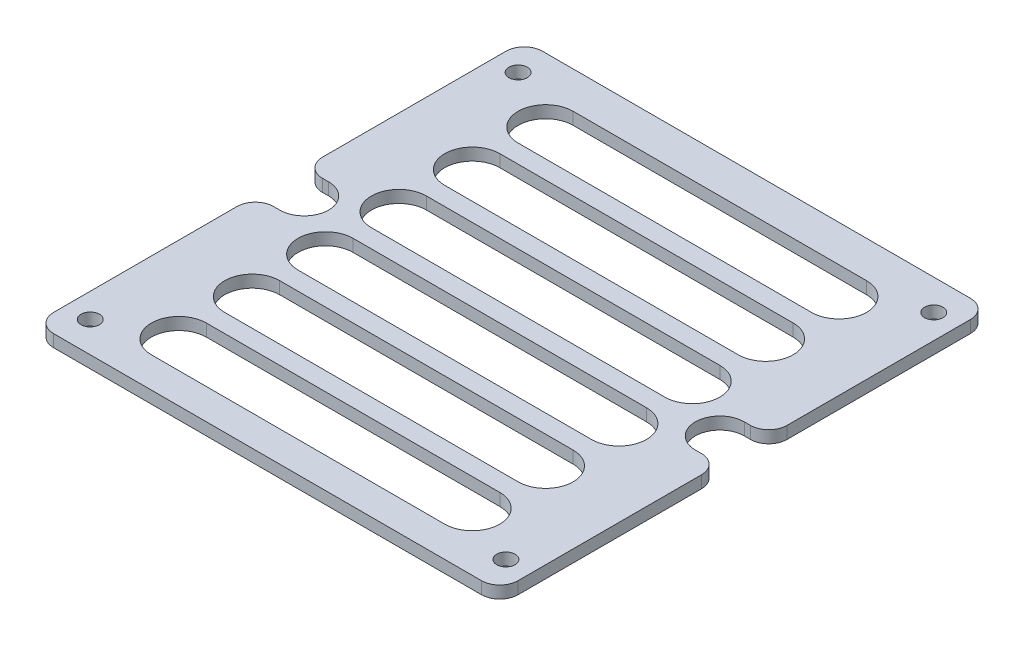
from build123d import *

# Parameters (mm, degrees)
EXTRUDE_1_DEPTH          = 2
SKETCH_2_R               = 1.5
CUT_EXTRUDE_1_DEPTH      = 56.208694967
MIRROR_2_COPY_1_SKETCH_R = 1.5
MIRROR_2_COPY_1_DEPTH    = 56.208694967
CUT_EXTRUDE_2_DEPTH      = 56.208694967
PATTERN_LINEAR_1_COUNT   = 6
PATTERN_LINEAR_1_PITCH   = 12
SKETCH_4_W               = 60
SKETCH_4_H               = 2
EXTRUDE_2_DEPTH          = 8
CUT_EXTRUDE_3_DEPTH      = 56.208694967
FILLET_1_R               = 3


with BuildPart() as part:
    # 草图1 → 凸台-拉伸1 (new body)
    with BuildSketch(Plane(origin=(0, 0, 0), x_dir=(1, 0, 0), z_dir=(0, 1, 0))):
        Polygon((-38, -30), (-38, -40), (38, -40), (38, -30), (30, -30), (30, 30), (38, 30), (38, 40), (-38, 40), (-38, 30), (-30, 30), (-30, -30), align=None)
    extrude(amount=EXTRUDE_1_DEPTH)

    # 草图2 → 切除-拉伸1 (cut, through all)
    with BuildSketch(Plane(origin=(0, 2, 0), x_dir=(1, 0, 0), z_dir=(0, 1, 0))):
        with Locations(Location((-34, 35, 0), (0, 0, 270))):
            Circle(SKETCH_2_R)
    cut_extrude_1 = extrude(amount=-CUT_EXTRUDE_1_DEPTH, mode=Mode.SUBTRACT)

    # 镜向1: 切除-拉伸1 across plane
    add(cut_extrude_1.mirror(Plane(origin=(0, 0, 0), x_dir=(0, 0, 1), z_dir=(1, 0, 0))), mode=Mode.SUBTRACT)

    # 镜向2: 切除-拉伸1 across plane
    add(cut_extrude_1.mirror(Plane.XY), mode=Mode.SUBTRACT)

    # 镜向2 copy 1 sketch → 镜向2 copy 1 (cut, through all)
    with BuildSketch(Plane(origin=(0, 2, 0), x_dir=(-1, 0, 0), z_dir=(0, 1, 0))):
        with Locations(Location((-34, 35, 0), (0, 0, 270))):
            Circle(MIRROR_2_COPY_1_SKETCH_R)
    extrude(amount=-MIRROR_2_COPY_1_DEPTH, mode=Mode.SUBTRACT)

    # 草图3 → 切除-拉伸2 (cut, through all)
    with BuildSketch(Plane(origin=(0, 2, 0), x_dir=(1, 0, 0), z_dir=(0, 1, 0))):
        with BuildLine():
            Line((-24, 34), (24, 34))
            ThreePointArc((24, 34), (28.5, 29.5), (24, 25))
            Line((24, 25), (-24, 25))
            ThreePointArc((-24, 25), (-28.5, 29.5), (-24, 34))
        make_face()
    cut_extrude_2 = extrude(amount=-CUT_EXTRUDE_2_DEPTH, mode=Mode.SUBTRACT)

    # 阵列(线性)1: 切除-拉伸2 ×6
    with Locations(*[(0, 0, i * PATTERN_LINEAR_1_PITCH) for i in range(1, PATTERN_LINEAR_1_COUNT)]):
        add(cut_extrude_2, mode=Mode.SUBTRACT)

    # 草图4 → 凸台-拉伸2 (add)
    with BuildSketch(Plane(origin=(30, 0, 0), x_dir=(0, 0, -1), z_dir=(1, 0, 0))):
        with Locations((0, 1)):
            Rectangle(SKETCH_4_W, SKETCH_4_H)
    extrude_2 = extrude(amount=EXTRUDE_2_DEPTH)

    # 镜向3: 凸台-拉伸2 across plane
    add(extrude_2.mirror(Plane(origin=(0, 0, 0), x_dir=(0, 0, 1), z_dir=(1, 0, 0))))

    # 草图6 → 切除-拉伸3 (cut, through all)
    with BuildSketch(Plane(origin=(0, 2, 0), x_dir=(1, 0, 0), z_dir=(0, 1, 0))):
        with BuildLine():
            Line((-38, 4), (-34, 4))
            ThreePointArc((-34, 4), (-30, 0), (-34, -4))
            Line((-34, -4), (-38, -4))
            Line((-38, -4), (-38, 4))
        make_face()
        with BuildLine():
            Line((38, -4), (38, 4))
            Line((38, 4), (34, 4))
            ThreePointArc((34, 4), (30, 0), (34, -4))
            Line((34, -4), (38, -4))
        make_face()
    extrude(amount=-CUT_EXTRUDE_3_DEPTH, mode=Mode.SUBTRACT)

    # 圆角1
    fillet_1_edges = [part.edges().sort_by_distance(p)[0] for p in [
        (-38, 1, 4),
        (-38, 1, -4),
        (38, 1, -4),
        (38, 1, 4),
        (38, 1, 40),
        (-38, 1, 40),
        (-38, 1, -40),
        (38, 1, -40),
    ]]
    fillet(fillet_1_edges, radius=FILLET_1_R)


solid = part.part
